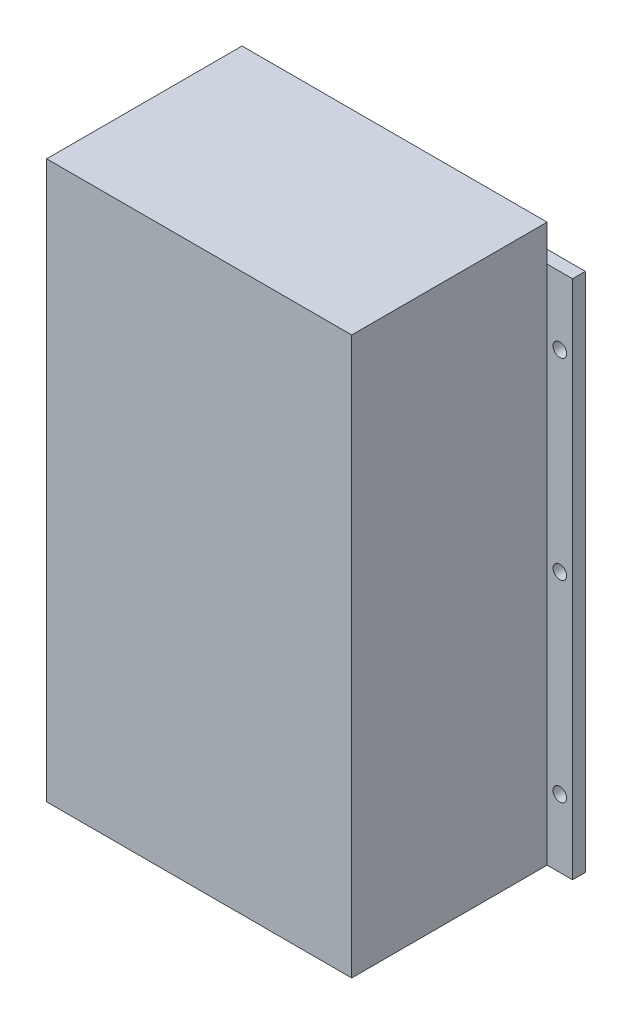
from build123d import *

# Parameters (mm, degrees)
SKETCH2_W                = 126
SKETCH2_H                = 215
BOSS_EXTRUDE1_DEPTH      = 86
BOSS_EXTRUDE2_DEPTH      = 10.5
BOSS_EXTRUDE2_DEPTH_BACK = 136.5
SKETCH3_W                = 5.3
SKETCH3_H                = 215
SKETCH5_R                = 2.8
CUT_EXTRUDE1_DEPTH       = 10.5
SKETCH6_R                = 2.8
CUT_EXTRUDE2_DEPTH       = 10.5
SKETCH7_R                = 2.8
CUT_EXTRUDE3_DEPTH       = 10.5
LPATTERN1_COUNT          = 2
LPATTERN1_PITCH          = 136.5
SKETCH8_W                = 126
SKETCH8_H                = 80.7
BOSS_EXTRUDE3_DEPTH      = 15


with BuildPart() as part:
    # Sketch2 → Boss-Extrude1 (new body)
    with BuildSketch(Plane.XY):
        with Locations((63, 107.5)):
            Rectangle(SKETCH2_W, SKETCH2_H)
    extrude(amount=BOSS_EXTRUDE1_DEPTH)

    # Sketch3 → Boss-Extrude2 (add, two sides: drawn at the far end of the back side and taken through both)
    with BuildSketch(Plane(origin=(126, 0, 0), x_dir=(0, 0, -1), z_dir=(1, 0, 0)).offset(-BOSS_EXTRUDE2_DEPTH_BACK)):
        with Locations((-2.65, 107.5)):
            Rectangle(SKETCH3_W, SKETCH3_H)
    extrude(amount=BOSS_EXTRUDE2_DEPTH + BOSS_EXTRUDE2_DEPTH_BACK)

    # Sketch5 → Cut-Extrude1 (cut)
    with BuildSketch(Plane.XY.offset(5.3)):
        with Locations((131.25, 28)):
            Circle(SKETCH5_R)
    cut_extrude1 = extrude(amount=-CUT_EXTRUDE1_DEPTH, mode=Mode.SUBTRACT)

    # Sketch6 → Cut-Extrude2 (cut)
    with BuildSketch(Plane.XY.offset(5.3)):
        with Locations((131.25, 107.5)):
            Circle(SKETCH6_R)
    cut_extrude2 = extrude(amount=-CUT_EXTRUDE2_DEPTH, mode=Mode.SUBTRACT)

    # Sketch7 → Cut-Extrude3 (cut)
    with BuildSketch(Plane.XY.offset(5.3)):
        with Locations((131.25, 187)):
            Circle(SKETCH7_R)
    cut_extrude3 = extrude(amount=-CUT_EXTRUDE3_DEPTH, mode=Mode.SUBTRACT)

    # LPattern1: Cut-Extrude1, Cut-Extrude2, Cut-Extrude3 ×2
    with Locations(*[(-i * LPATTERN1_PITCH, 0, 0) for i in range(1, LPATTERN1_COUNT)]):
        add(cut_extrude1, mode=Mode.SUBTRACT)
        add(cut_extrude2, mode=Mode.SUBTRACT)
        add(cut_extrude3, mode=Mode.SUBTRACT)

    # Sketch8 → Boss-Extrude3 (add)
    with BuildSketch(Plane(origin=(0, 215, 0), x_dir=(1, 0, 0), z_dir=(0, 1, 0))):
        with Locations((63, -45.65)):
            Rectangle(SKETCH8_W, SKETCH8_H)
    extrude(amount=BOSS_EXTRUDE3_DEPTH)


solid = part.part
